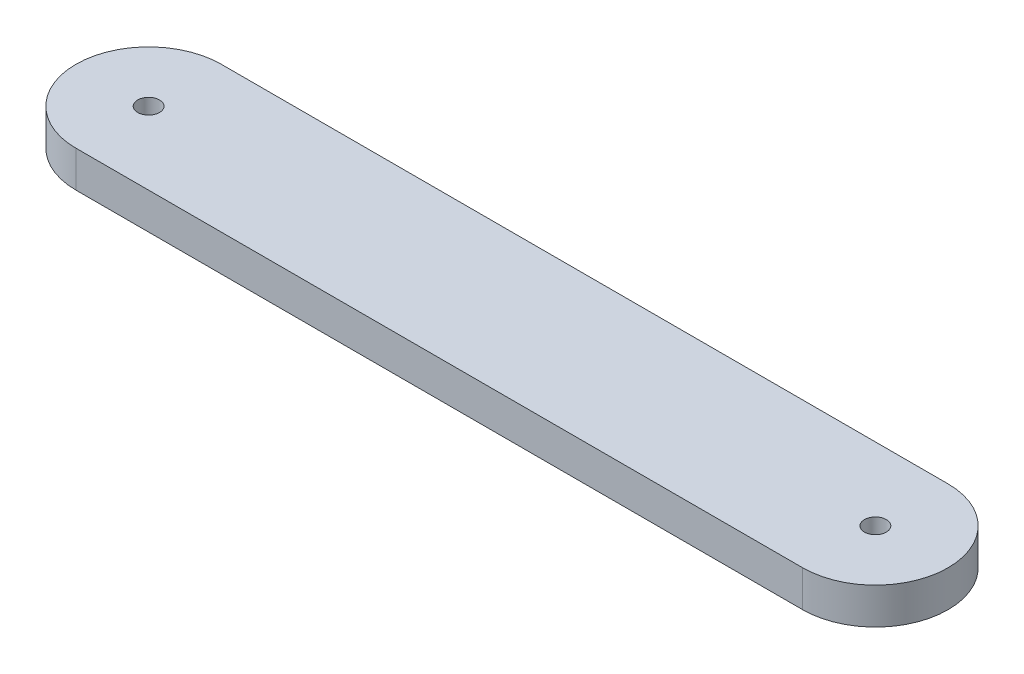
from build123d import *

# Parameters (mm, degrees)
BOSS_EXTRUDE1_DEPTH = 5
CUT_EXTRUDE1_REACH  = 63.033
SKETCH2_R           = 1.5


with BuildPart() as part:
    # Sketch1 → Boss-Extrude1 (new body)
    with BuildSketch(Plane(origin=(0, 0, 0), x_dir=(1, 0, 0), z_dir=(0, 1, 0))):
        with BuildLine():
            Line((-50, 10), (50, 10))
            ThreePointArc((50, 10), (60, 0), (50, -10))
            Line((50, -10), (-50, -10))
            ThreePointArc((-50, -10), (-60, 0), (-50, 10))
        make_face()
    extrude(amount=BOSS_EXTRUDE1_DEPTH)

    # Sketch2 → Cut-Extrude1 (cut, up to next)
    with BuildSketch(Plane(origin=(0, 5, 0), x_dir=(1, 0, 0), z_dir=(0, 1, 0)), mode=Mode.PRIVATE) as cut_extrude1_sk1:
        with Locations(Location((-50, 0, 0), (0, 0, 270))):
            Circle(SKETCH2_R)
    cut_extrude1_tool1 = extrude(cut_extrude1_sk1.sketch, amount=-CUT_EXTRUDE1_REACH, mode=Mode.PRIVATE) & part.part
    # Sketch2 → Cut-Extrude1 (cut, up to next)
    with BuildSketch(Plane(origin=(0, 5, 0), x_dir=(1, 0, 0), z_dir=(0, 1, 0)), mode=Mode.PRIVATE) as cut_extrude1_sk2:
        with Locations(Location((50, 0, 0), (0, 0, 270))):
            Circle(SKETCH2_R)
    cut_extrude1_tool2 = extrude(cut_extrude1_sk2.sketch, amount=-CUT_EXTRUDE1_REACH, mode=Mode.PRIVATE) & part.part
    add(cut_extrude1_tool1.solids().sort_by_distance((-50, 5, 0))[0], mode=Mode.SUBTRACT)
    add(cut_extrude1_tool2.solids().sort_by_distance((50, 5, 0))[0], mode=Mode.SUBTRACT)


solid = part.part
